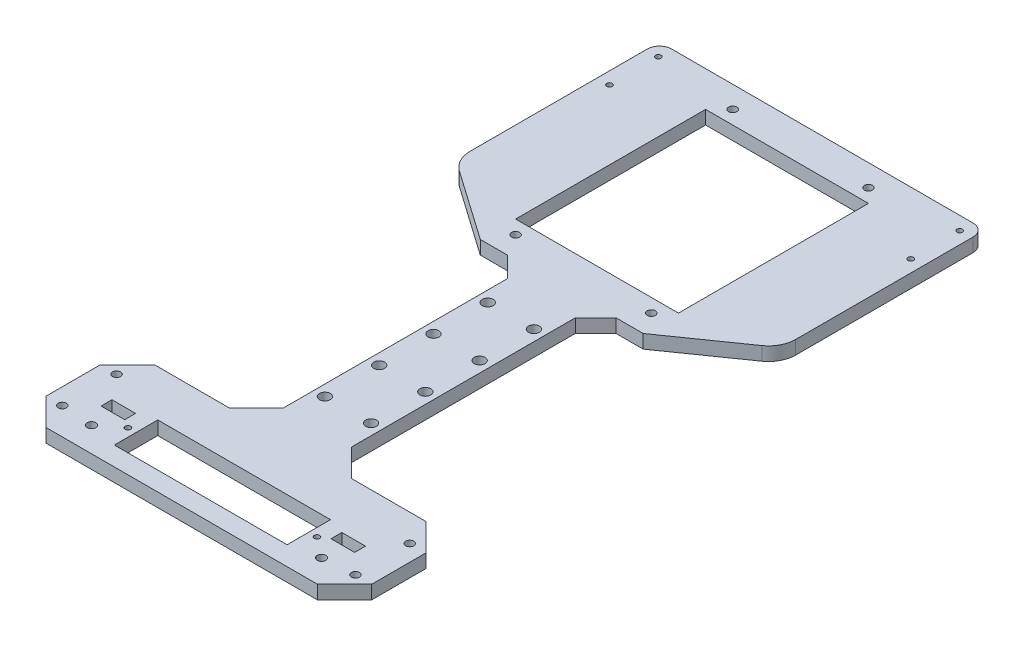
from build123d import *

# Parameters (mm, degrees)
BASE_DEPTH               = 5
ESBO_O2_R                = 1
FURO_BRACKET_MOTOR_DEPTH = 3
ESBO_O4_W                = 60
ESBO_O4_H                = 70
ENCAIXE_PCB_DEPTH        = 236.334523507
ESBO_O6_R                = 1.5
PARAFUSO_PCB_DEPTH       = 236.334523507
ESBO_O7_R                = 2
ENFORCA_GATO_DEPTH       = 236.334523507
ESBO_O8_R                = 1.5
PARAFUSO_APOIO_DEPTH     = 10
ESBO_O9_R                = 1
ESBO_O9_R_2              = 1.6
ESBO_O9_W                = 63.64
ESBO_O9_H                = 16
ESBO_O9_W_2              = 8.7
ESBO_O9_H_2              = 4
CORTE_EXTRUS_O1_DEPTH    = 10


with BuildPart() as part:
    # Esboço1 → Base (new body)
    with BuildSketch(Plane(origin=(0, 0, 0), x_dir=(1, 0, 0), z_dir=(0, 1, 0))):
        with BuildLine():
            Line((-18.088885989, 17.941465294), (-18.088885989, 19.441465294))
            ThreePointArc((-18.088885989, 19.441465294), (-16.770866504, 22.623445809), (-13.588885989, 23.941465294))
            Line((-13.588885989, 23.941465294), (97.411114011, 23.941465294))
            ThreePointArc((97.411114011, 23.941465294), (100.593094526, 22.623445809), (101.911114011, 19.441465294))
            Line((101.911114011, 19.441465294), (101.911114011, 17.941465294))
            Line((101.911114011, 17.941465294), (101.911114011, -45.8528642))
            ThreePointArc((101.911114011, -45.8528642), (100.781222343, -50.470350333), (97.646878374, -54.044384643))
            Line((97.646878374, -54.044384643), (71.911114011, -72.064760852))
            Line((71.911114011, -72.064760852), (61.911114011, -72.064760852))
            Line((61.911114011, -72.064760852), (54.411114011, -79.564760852))
            Line((54.411114011, -79.564760852), (54.411114011, -162.064760852))
            Line((54.411114011, -162.064760852), (64.411114011, -172.064760852))
            Line((64.411114011, -172.064760852), (91.911114011, -172.064760852))
            Line((91.911114011, -172.064760852), (101.911114011, -182.064760852))
            Line((101.911114011, -182.064760852), (101.911114011, -202.064760852))
            Line((101.911114011, -202.064760852), (91.911114011, -212.064760852))
            Line((91.911114011, -212.064760852), (-8.088885989, -212.064760852))
            Line((-8.088885989, -212.064760852), (-18.088885989, -202.064760852))
            Line((-18.088885989, -202.064760852), (-18.088885989, -182.064760852))
            Line((-18.088885989, -182.064760852), (-8.088885989, -172.064760852))
            Line((-8.088885989, -172.064760852), (19.411114011, -172.064760852))
            Line((19.411114011, -172.064760852), (29.411114011, -162.064760852))
            Line((29.411114011, -162.064760852), (29.411114011, -79.564760852))
            Line((29.411114011, -79.564760852), (21.911114011, -72.064760852))
            Line((21.911114011, -72.064760852), (11.911114011, -72.064760852))
            Line((11.911114011, -72.064760852), (-13.824650353, -54.044384643))
            ThreePointArc((-13.824650353, -54.044384643), (-16.958994321, -50.470350333), (-18.088885989, -45.8528642))
            Line((-18.088885989, -45.8528642), (-18.088885989, 17.941465294))
        make_face()
    extrude(amount=BASE_DEPTH)

    # Esboço2 → Furo Bracket Motor (cut)
    with BuildSketch(Plane(origin=(0, 5, 0), x_dir=(1, 0, 0), z_dir=(0, 1, 0))):
        with Locations(Location((-13.588885989, 19.021465294, 0), (0, 0, 270))):
            Circle(ESBO_O2_R)
        with Locations(Location((-13.588885989, 1.021465294, 0), (0, 0, 270))):
            Circle(ESBO_O2_R)
        with Locations(Location((97.411114011, 1.021465294, 0), (0, 0, 90))):
            Circle(ESBO_O2_R)
        with Locations(Location((97.411114011, 19.021465294, 0), (0, 0, 90))):
            Circle(ESBO_O2_R)
    extrude(amount=-FURO_BRACKET_MOTOR_DEPTH, mode=Mode.SUBTRACT)

    # Esboço4 → Encaixe PCB (cut, through all)
    with BuildSketch(Plane.XZ):
        with Locations((41.911114011, 24.063534706)):
            Rectangle(ESBO_O4_W, ESBO_O4_H)
    extrude(amount=-ENCAIXE_PCB_DEPTH, mode=Mode.SUBTRACT)

    # Esboço6 → Parafuso PCB (cut, through all)
    with BuildSketch(Plane.XZ):
        with Locations(Location((16.911114011, 64.063534706, 0), (0, 0, 270))):
            Circle(ESBO_O6_R)
        with Locations(Location((66.911114011, 64.063534706, 0), (0, 0, 270))):
            Circle(ESBO_O6_R)
        with Locations(Location((66.911114011, -15.936465294, 0), (0, 0, 270))):
            Circle(ESBO_O6_R)
        with Locations(Location((16.911114011, -15.936465294, 0), (0, 0, 270))):
            Circle(ESBO_O6_R)
    extrude(amount=-PARAFUSO_PCB_DEPTH, mode=Mode.SUBTRACT)

    # Esboço7 → Enforca Gato (cut, through all)
    with BuildSketch(Plane.XZ):
        with Locations(Location((33.411114011, 90.814760852, 0), (0, 0, 270))):
            Circle(ESBO_O7_R)
        with Locations(Location((33.411114011, 110.814760852, 0), (0, 0, 270))):
            Circle(ESBO_O7_R)
        with Locations(Location((33.411114011, 130.814760852, 0), (0, 0, 270))):
            Circle(ESBO_O7_R)
        with Locations(Location((33.411114011, 150.814760852, 0), (0, 0, 270))):
            Circle(ESBO_O7_R)
        with Locations(Location((50.411114011, 150.814760852, 0), (0, 0, 90))):
            Circle(ESBO_O7_R)
        with Locations(Location((50.411114011, 130.814760852, 0), (0, 0, 90))):
            Circle(ESBO_O7_R)
        with Locations(Location((50.411114011, 110.814760852, 0), (0, 0, 90))):
            Circle(ESBO_O7_R)
        with Locations(Location((50.411114011, 90.814760852, 0), (0, 0, 90))):
            Circle(ESBO_O7_R)
    extrude(amount=-ENFORCA_GATO_DEPTH, mode=Mode.SUBTRACT)

    # Esboço8 → Parafuso Apoio (cut)
    with BuildSketch(Plane.XZ):
        with Locations(Location((95.911114011, 182.064760852, 0), (0, 0, 270))):
            Circle(ESBO_O8_R)
        with Locations(Location((95.911114011, 202.064760852, 0), (0, 0, 270))):
            Circle(ESBO_O8_R)
        with Locations(Location((-12.088885989, 202.064760852, 0), (0, 0, 270))):
            Circle(ESBO_O8_R)
        with Locations(Location((-12.088885989, 182.064760852, 0), (0, 0, 270))):
            Circle(ESBO_O8_R)
    extrude(amount=-PARAFUSO_APOIO_DEPTH, mode=Mode.SUBTRACT)

    # Esboço9 → Corte-extrusão1 (cut)
    with BuildSketch(Plane(origin=(0, 5, 0), x_dir=(1, 0, 0), z_dir=(0, 1, 0))):
        with Locations(Location((76.731114011, -197.064760852, 0), (0, 0, 270))):
            Circle(ESBO_O9_R)
        with Locations(Location((7.091114011, -197.064760852, 0), (0, 0, 270))):
            Circle(ESBO_O9_R)
        with Locations(Location((-0.438885989, -202.924760852, 0), (0, 0, 270))):
            Circle(ESBO_O9_R_2)
        with Locations(Location((84.261114011, -202.924760852, 0), (0, 0, 90))):
            Circle(ESBO_O9_R_2)
        with Locations((41.911114011, -197.064760852)):
            Rectangle(ESBO_O9_W, ESBO_O9_H)
        with Locations((-0.438885989, -193.064760852)):
            Rectangle(ESBO_O9_W_2, ESBO_O9_H_2)
        with Locations((84.261114011, -193.064760852)):
            Rectangle(ESBO_O9_W_2, ESBO_O9_H_2)
    extrude(amount=-CORTE_EXTRUS_O1_DEPTH, mode=Mode.SUBTRACT)


solid = part.part
